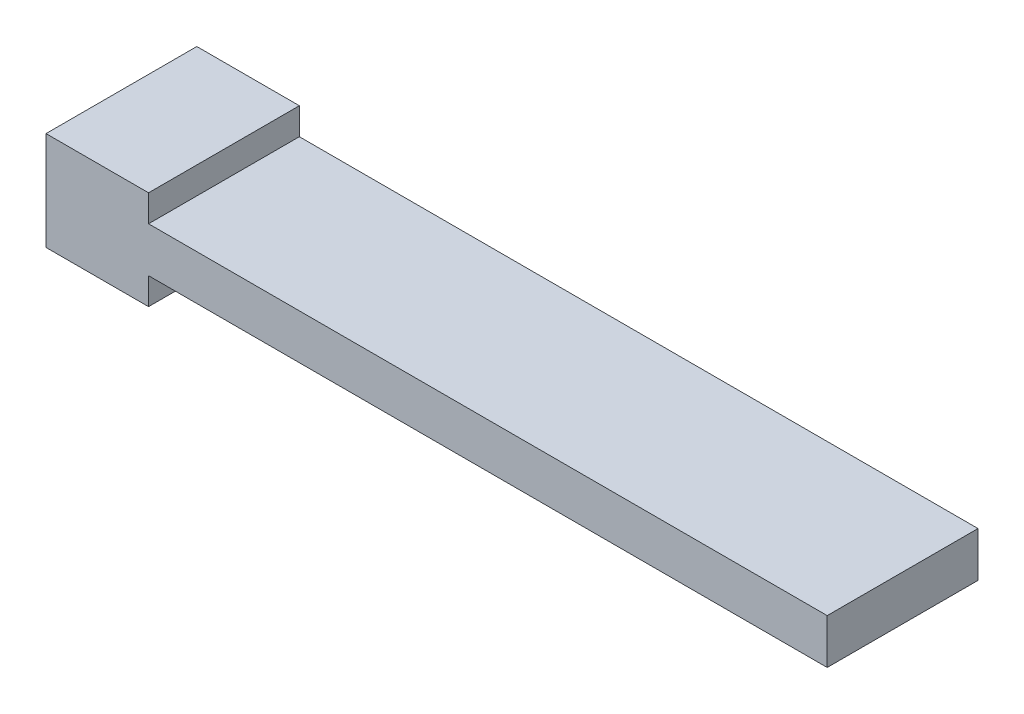
from build123d import *

# Parameters (mm, degrees)
BOSS_EXTRUDE1_DEPTH = 10


with BuildPart() as part:
    # Sketch1 → Boss-Extrude1 (new body)
    with BuildSketch(Plane.XY):
        Polygon((0, 0), (0, 2.9275), (6.8, 2.9275), (6.8, 1.1475), (51.8, 1.1475), (51.8, -1.8325), (6.8, -1.8325), (6.8, -3.6125), (0, -3.6125), align=None)
    extrude(amount=BOSS_EXTRUDE1_DEPTH)


solid = part.part
